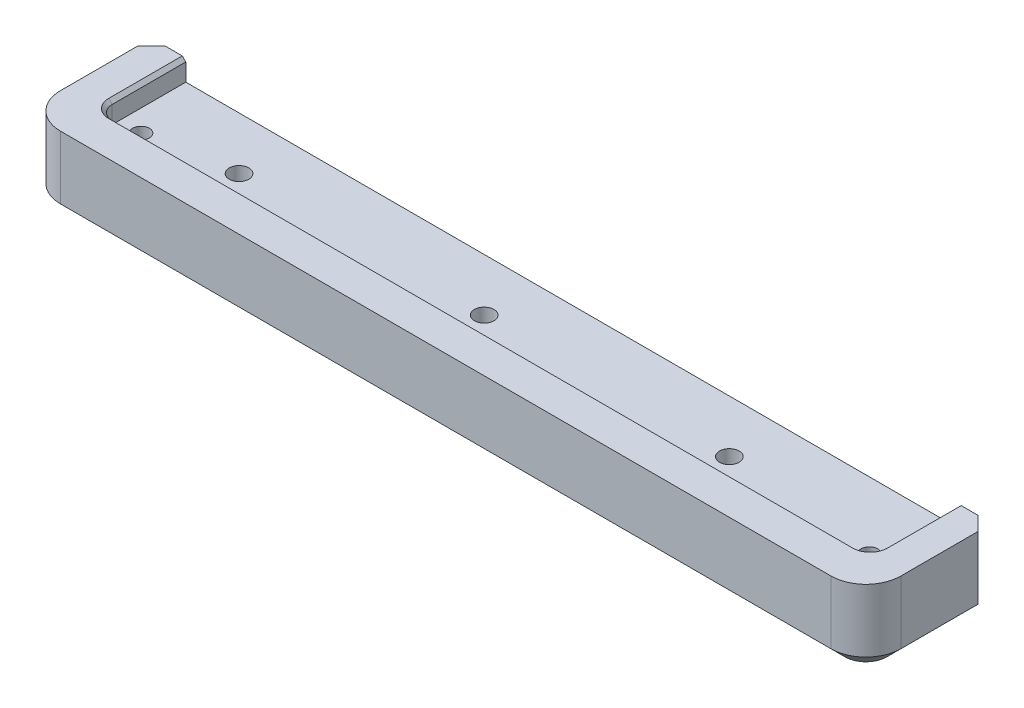
from build123d import *

# Parameters (mm, degrees)
SKETCH_1_W      = 120
SKETCH_1_H      = 18
SKETCH_1_R      = 1.4
SKETCH_1_R_2    = 1.2
EXTRUDE_1_DEPTH = 5
EXTRUDE_2_DEPTH = 3
SKETCH_3_R      = 2.5
EXTRUDE_3_DEPTH = 3
FILLET_1_R      = 5
CHAMFER_1_SIZE  = 0.5
CHAMFER_2_SIZE  = 2
CHAMFER_3_SIZE  = 2


with BuildPart() as part:
    # 草图1 → 凸台-拉伸1 (new body)
    with BuildSketch(Plane(origin=(0, 0, 0), x_dir=(1, 0, 0), z_dir=(0, 1, 0))):
        Rectangle(SKETCH_1_W, SKETCH_1_H)
        with Locations((30, 1.5)):
            Circle(SKETCH_1_R, mode=Mode.SUBTRACT)
        with Locations((-5, 1.5)):
            Circle(SKETCH_1_R, mode=Mode.SUBTRACT)
        with Locations((-40, 1.5)):
            Circle(SKETCH_1_R, mode=Mode.SUBTRACT)
        with Locations((52, -0.5)):
            Circle(SKETCH_1_R_2, mode=Mode.SUBTRACT)
        with Locations((-52, -0.5)):
            Circle(SKETCH_1_R_2, mode=Mode.SUBTRACT)
    extrude(amount=EXTRUDE_1_DEPTH)

    # 草图2 → 凸台-拉伸2 (add)
    with BuildSketch(Plane(origin=(0, 5, 0), x_dir=(1, 0, 0), z_dir=(0, 1, 0))):
        with BuildLine():
            Line((-55.1, 9), (-55.1, -1.5))
            ThreePointArc((-55.1, -1.5), (-54.514213562, -2.914213562), (-53.1, -3.5))
            Line((-53.1, -3.5), (53.1, -3.5))
            ThreePointArc((53.1, -3.5), (54.514213562, -2.914213562), (55.1, -1.5))
            Line((55.1, -1.5), (55.1, 9))
            Line((55.1, 9), (60, 9))
            Line((60, 9), (60, -9))
            Line((60, -9), (-60, -9))
            Line((-60, -9), (-60, 9))
            Line((-60, 9), (-55.1, 9))
        make_face()
    extrude(amount=EXTRUDE_2_DEPTH)

    # 草图3 → 凸台-拉伸3 (add)
    with BuildSketch(Plane.XZ):
        with BuildLine():
            Line((-50.990381057, -3.8), (-53.992602457, -9))
            Line((-53.992602457, -9), (-60, -9))
            Line((-60, -9), (-60, 9))
            Line((-60, 9), (60, 9))
            Line((60, 9), (60, -9))
            Line((60, -9), (43.992602457, -9))
            Line((43.992602457, -9), (40.990381057, -3.8))
            ThreePointArc((40.990381057, -3.8), (35.5, 1.690381057), (28, 3.7))
            Line((28, 3.7), (-38, 3.7))
            ThreePointArc((-38, 3.7), (-43.896602634, 2.492392011), (-48.843767341, -0.935989683))
            ThreePointArc((-48.843767341, -0.935989683), (-49.473949116, -1.012171842), (-49.671021877, -0.408768893))
            ThreePointArc((-49.671021877, -0.408768893), (-53.911569658, 2.11118014), (-50.710028515, -1.641488634))
            ThreePointArc((-50.710028515, -1.641488634), (-50.081970455, -1.733553091), (-50.050355695, -2.367535187))
            ThreePointArc((-50.050355695, -2.367535187), (-50.540837816, -3.070334948), (-50.990381057, -3.8))
        make_face()
        with Locations((52, 0.5)):
            Circle(SKETCH_3_R, mode=Mode.SUBTRACT)
    extrude(amount=EXTRUDE_3_DEPTH)

    # 圆角1
    fillet_1_edges = [part.edges().sort_by_distance(p)[0] for p in [
        (60, 2.5, 9),
        (-60, 2.5, 9),
    ]]
    fillet(fillet_1_edges, radius=FILLET_1_R)

    # 倒角1
    chamfer_1_edges = [part.edges().sort_by_distance(p)[0] for p in [
        (55.1, 8, -3.75),
        (-55.1, 8, -3.75),
        (54.514213562, 8, 2.914213562),
        (-54.514213562, 8, 2.914213562),
        (0, 8, 3.5),
    ]]
    chamfer(chamfer_1_edges, length=CHAMFER_1_SIZE)

    # 倒角2
    chamfer_2_edges = [part.edges().sort_by_distance(p)[0] for p in [
        (-60, 2.5, -9),
        (60, 2.5, -9),
    ]]
    chamfer(chamfer_2_edges, length=CHAMFER_2_SIZE)

    # 倒角3
    chamfer_3_edges = [part.edges().sort_by_distance(p)[0] for p in [
        (60, -3, -1.5),
        (-60, -3, -1.5),
        (58.535533906, -3, 7.535533906),
        (-58.535533906, -3, 7.535533906),
        (0, -3, 9),
    ]]
    chamfer(chamfer_3_edges, length=CHAMFER_3_SIZE)


solid = part.part
